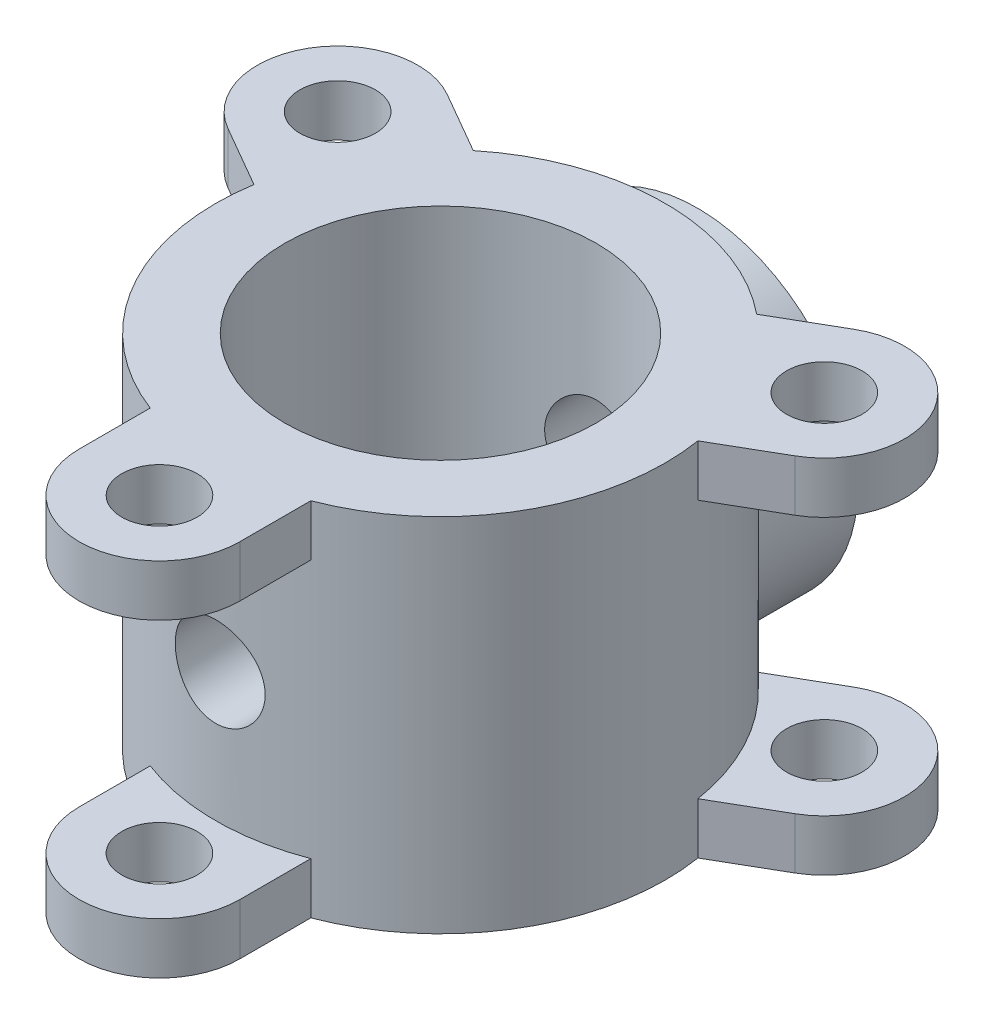
from build123d import *

# Parameters (mm, degrees)
SKETCH3_R               = 140
BOSS_EXTRUDE1_DEPTH     = 225
SKETCH4_R               = 97
CUT_EXTRUDE1_DEPTH      = 300.708191413
BOSS_EXTRUDE3_DEPTH     = 32
SKETCH11_R              = 23.5
CUT_EXTRUDE3_DEPTH      = 348.634865915
CIRPATTERN15_COUNT      = 3
MIRROR6_COPY_1_DEPTH    = 32
MIRROR6_COPY_2_DEPTH    = 32
MIRROR6_COPY_3_SKETCH_R = 23.5
MIRROR6_COPY_3_DEPTH    = 348.634865915
MIRROR6_COPY_4_SKETCH_R = 23.5
MIRROR6_COPY_4_DEPTH    = 348.634865915
SKETCH16_R              = 100
BOSS_EXTRUDE4_DEPTH     = 160
SKETCH17_R              = 50
CUT_EXTRUDE4_DEPTH      = 25
SKETCH18_R              = 28
CUT_EXTRUDE5_DEPTH      = 470.945948606
SKETCH19_R              = 12
CUT_EXTRUDE6_DEPTH      = 15
SKETCH20_R              = 97
CUT_EXTRUDE7_DEPTH      = 377.661910221


with BuildPart() as part:
    # Sketch3 → Boss-Extrude1 (new body)
    with BuildSketch(Plane(origin=(0, 0, 0), x_dir=(1, 0, 0), z_dir=(0, 1, 0))):
        with Locations(Location((0, 0, 0), (0, 0, 270))):
            Circle(SKETCH3_R)
    extrude(amount=BOSS_EXTRUDE1_DEPTH)

    # Sketch4 → Cut-Extrude1 (cut, through all)
    with BuildSketch(Plane.XZ):
        with Locations(Location((0, 0, 0), (0, 0, 270))):
            Circle(SKETCH4_R)
    extrude(amount=-CUT_EXTRUDE1_DEPTH, mode=Mode.SUBTRACT)

    # Sketch10 → Boss-Extrude3 (add)
    with BuildSketch(Plane.XZ):
        with BuildLine():
            Line((-50, 175), (-50, 130.766968306))
            ThreePointArc((-50, 130.766968306), (0, 140), (50, 130.766968306))
            Line((50, 130.766968306), (50, 175))
            ThreePointArc((50, 175), (0, 225), (-50, 175))
        make_face()
    boss_extrude3 = extrude(amount=-BOSS_EXTRUDE3_DEPTH)

    # Sketch11 → Cut-Extrude3 (cut, through all)
    with BuildSketch(Plane.XZ):
        with Locations(Location((0, 175, 0), (0, 0, 270))):
            Circle(SKETCH11_R)
    cut_extrude3 = extrude(amount=-CUT_EXTRUDE3_DEPTH, mode=Mode.SUBTRACT)

    # CirPattern15: Boss-Extrude3, Cut-Extrude3 ×3 about axis
    cirpattern15_axis = Axis((0, 0, 0), (0, 1, 0))
    add([boss_extrude3.rotate(cirpattern15_axis, i * 360 / CIRPATTERN15_COUNT) for i in range(1, CIRPATTERN15_COUNT)])
    add([cut_extrude3.rotate(cirpattern15_axis, i * 360 / CIRPATTERN15_COUNT) for i in range(1, CIRPATTERN15_COUNT)], mode=Mode.SUBTRACT)

    # Mirror6: Boss-Extrude3, Cut-Extrude3 across plane
    add(boss_extrude3.mirror(Plane.ZX.offset(112.5)))
    add(cut_extrude3.mirror(Plane.ZX.offset(112.5)), mode=Mode.SUBTRACT)

    # Mirror6 copy 1 sketch → Mirror6 copy 1 (add)
    with BuildSketch(Plane(origin=(0, 225, 0), x_dir=(-0.4999999999999998, 0, -0.8660254037844387), z_dir=(0, 1, 0))):
        with BuildLine():
            Line((-50, -175), (-50, -130.766968306))
            ThreePointArc((-50, -130.766968306), (0, -140), (50, -130.766968306))
            Line((50, -130.766968306), (50, -175))
            ThreePointArc((50, -175), (0, -225), (-50, -175))
        make_face()
    extrude(amount=-MIRROR6_COPY_1_DEPTH)

    # Mirror6 copy 2 sketch → Mirror6 copy 2 (add)
    with BuildSketch(Plane(origin=(0, 225, 0), x_dir=(-0.5000000000000004, 0, 0.8660254037844384), z_dir=(0, 1, 0))):
        with BuildLine():
            Line((-50, -175), (-50, -130.766968306))
            ThreePointArc((-50, -130.766968306), (0, -140), (50, -130.766968306))
            Line((50, -130.766968306), (50, -175))
            ThreePointArc((50, -175), (0, -225), (-50, -175))
        make_face()
    extrude(amount=-MIRROR6_COPY_2_DEPTH)

    # Mirror6 copy 3 sketch → Mirror6 copy 3 (cut, through all)
    with BuildSketch(Plane(origin=(0, 225, 0), x_dir=(-0.4999999999999998, 0, -0.8660254037844387), z_dir=(0, 1, 0))):
        with Locations((0, -175)):
            Circle(MIRROR6_COPY_3_SKETCH_R)
    extrude(amount=-MIRROR6_COPY_3_DEPTH, mode=Mode.SUBTRACT)

    # Mirror6 copy 4 sketch → Mirror6 copy 4 (cut, through all)
    with BuildSketch(Plane(origin=(0, 225, 0), x_dir=(-0.5000000000000004, 0, 0.8660254037844384), z_dir=(0, 1, 0))):
        with Locations((0, -175)):
            Circle(MIRROR6_COPY_4_SKETCH_R)
    extrude(amount=-MIRROR6_COPY_4_DEPTH, mode=Mode.SUBTRACT)

    # Sketch16 → Boss-Extrude4 (add)
    with BuildSketch(Plane.XY):
        with Locations((0, 112.5)):
            Circle(SKETCH16_R)
    extrude(amount=-BOSS_EXTRUDE4_DEPTH)

    # Sketch17 → Cut-Extrude4 (cut)
    with BuildSketch(Plane(origin=(0, 0, -160), x_dir=(-1, 0, 0), z_dir=(0, 0, -1))):
        with Locations((0, 112.5)):
            Circle(SKETCH17_R)
    extrude(amount=-CUT_EXTRUDE4_DEPTH, mode=Mode.SUBTRACT)

    # Sketch18 → Cut-Extrude5 (cut, through all)
    with BuildSketch(Plane(origin=(0, 0, -135), x_dir=(-1, 0, 0), z_dir=(0, 0, -1))):
        with Locations((0, 112.5)):
            Circle(SKETCH18_R)
    extrude(amount=-CUT_EXTRUDE5_DEPTH, mode=Mode.SUBTRACT)

    # Sketch19 → Cut-Extrude6 (cut)
    with BuildSketch(Plane(origin=(0, 0, -160), x_dir=(-1, 0, 0), z_dir=(0, 0, -1))):
        with Locations((0, 187.5)):
            Circle(SKETCH19_R)
        with Locations((64.951905284, 75)):
            Circle(SKETCH19_R)
        with Locations((-64.951905284, 75)):
            Circle(SKETCH19_R)
    extrude(amount=-CUT_EXTRUDE6_DEPTH, mode=Mode.SUBTRACT)

    # Sketch20 → Cut-Extrude7 (cut, through all)
    with BuildSketch(Plane.XZ):
        with Locations(Location((0, 0, 0), (0, 0, 270))):
            Circle(SKETCH20_R)
    extrude(amount=-CUT_EXTRUDE7_DEPTH, mode=Mode.SUBTRACT)


solid = part.part
